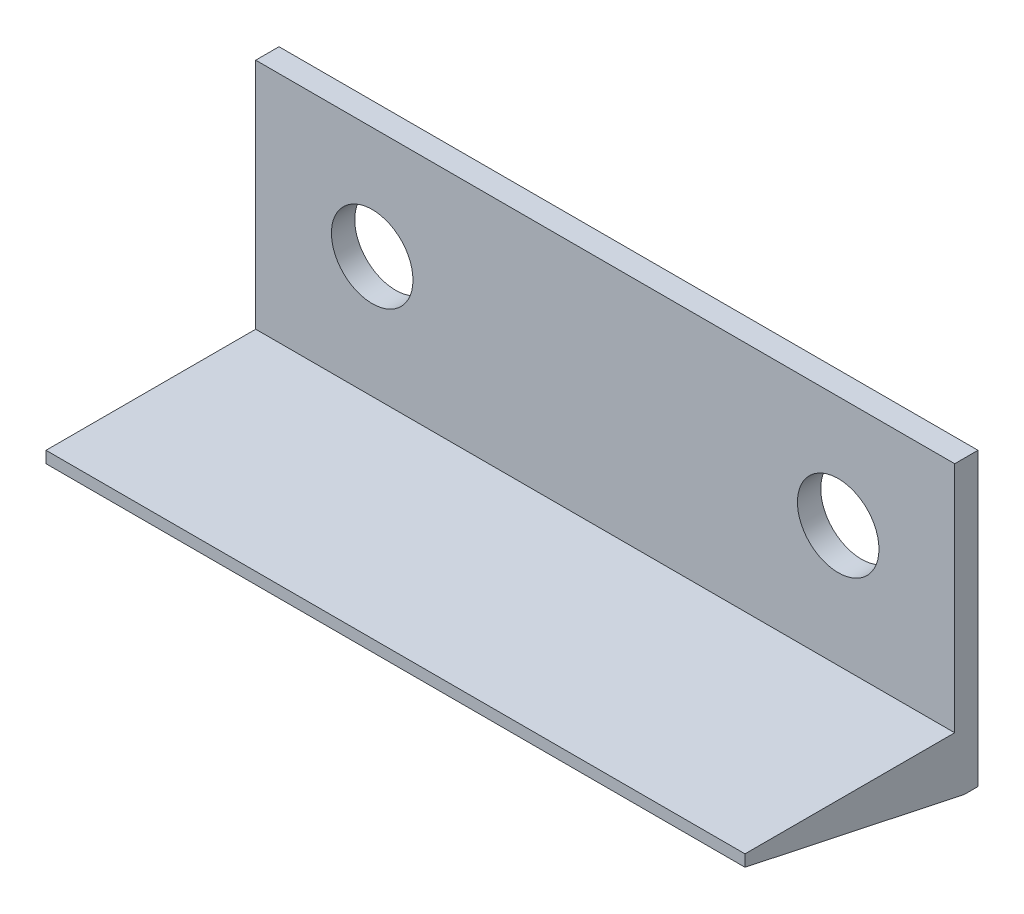
from build123d import *

# Parameters (mm, degrees)
SKETCH1_W           = 30
SKETCH1_H           = 10
SKETCH1_R           = 1.75
BOSS_EXTRUDE1_DEPTH = 1
SKETCH2_W           = 30
SKETCH2_H           = 2.5
BOSS_EXTRUDE2_DEPTH = 10
CHAMFER1_SIZE       = 2
CHAMFER1_SIZE2      = 9.409260219


with BuildPart() as part:
    # Sketch1 → Boss-Extrude1 (new body)
    with BuildSketch(Plane.XY):
        Rectangle(SKETCH1_W, SKETCH1_H)
        with Locations((-10, 0.2)):
            Circle(SKETCH1_R, mode=Mode.SUBTRACT)
        with Locations((10, 0.2)):
            Circle(SKETCH1_R, mode=Mode.SUBTRACT)
    extrude(amount=BOSS_EXTRUDE1_DEPTH)

    # Sketch2 → Boss-Extrude2 (add)
    with BuildSketch(Plane.XY):
        with Locations((0, -6.25)):
            Rectangle(SKETCH2_W, SKETCH2_H)
    extrude(amount=BOSS_EXTRUDE2_DEPTH)

    # Chamfer1
    chamfer1_edges = [part.edges().sort_by_distance(p)[0] for p in [
        (0, -7.5, 10),
    ]]
    chamfer1_side = [part.faces().sort_by_distance(p)[0] for p in [
        (0, -6.25, 10),
    ]]
    chamfer(chamfer1_edges, length=CHAMFER1_SIZE, length2=CHAMFER1_SIZE2, reference=chamfer1_side[0])


solid = part.part
